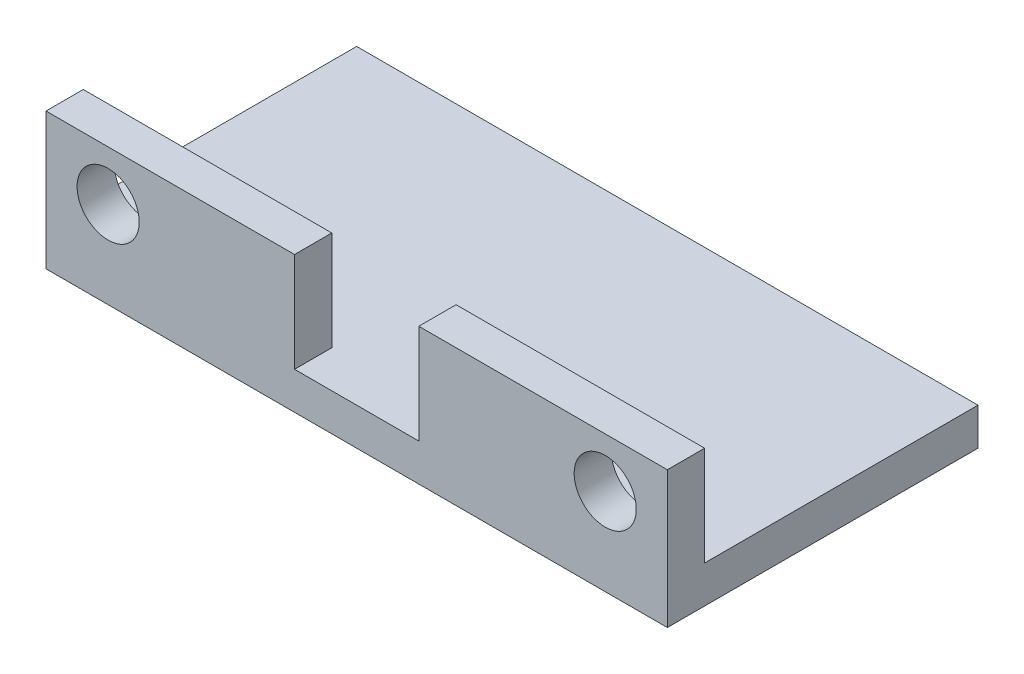
from build123d import *

# Parameters (mm, degrees)
SKETCH1_W           = 63.5
SKETCH1_H           = 31.75
BOSS_EXTRUDE1_DEPTH = 3.81
SKETCH2_W           = 25.4
SKETCH2_H           = 3.81
BOSS_EXTRUDE2_DEPTH = 10.16
SKETCH3_R           = 3.175
CUT_EXTRUDE1_DEPTH  = 3.81


with BuildPart() as part:
    # Sketch1 → Boss-Extrude1 (new body)
    with BuildSketch(Plane(origin=(0, 0, 0), x_dir=(1, 0, 0), z_dir=(0, 1, 0))):
        Rectangle(SKETCH1_W, SKETCH1_H)
    extrude(amount=BOSS_EXTRUDE1_DEPTH)

    # Sketch2 → Boss-Extrude2 (add)
    with BuildSketch(Plane(origin=(0, 3.81, 0), x_dir=(1, 0, 0), z_dir=(0, 1, 0))):
        with Locations((-19.05, -13.97)):
            Rectangle(SKETCH2_W, SKETCH2_H)
        with Locations((19.05, -13.97)):
            Rectangle(SKETCH2_W, SKETCH2_H)
    extrude(amount=BOSS_EXTRUDE2_DEPTH)

    # Sketch3 → Cut-Extrude1 (cut)
    with BuildSketch(Plane(origin=(0, 0, 12.065), x_dir=(-1, 0, 0), z_dir=(0, 0, -1))):
        with Locations((25.4, 8.89)):
            Circle(SKETCH3_R)
        with Locations((-25.4, 8.89)):
            Circle(SKETCH3_R)
    extrude(amount=-CUT_EXTRUDE1_DEPTH, mode=Mode.SUBTRACT)


solid = part.part
